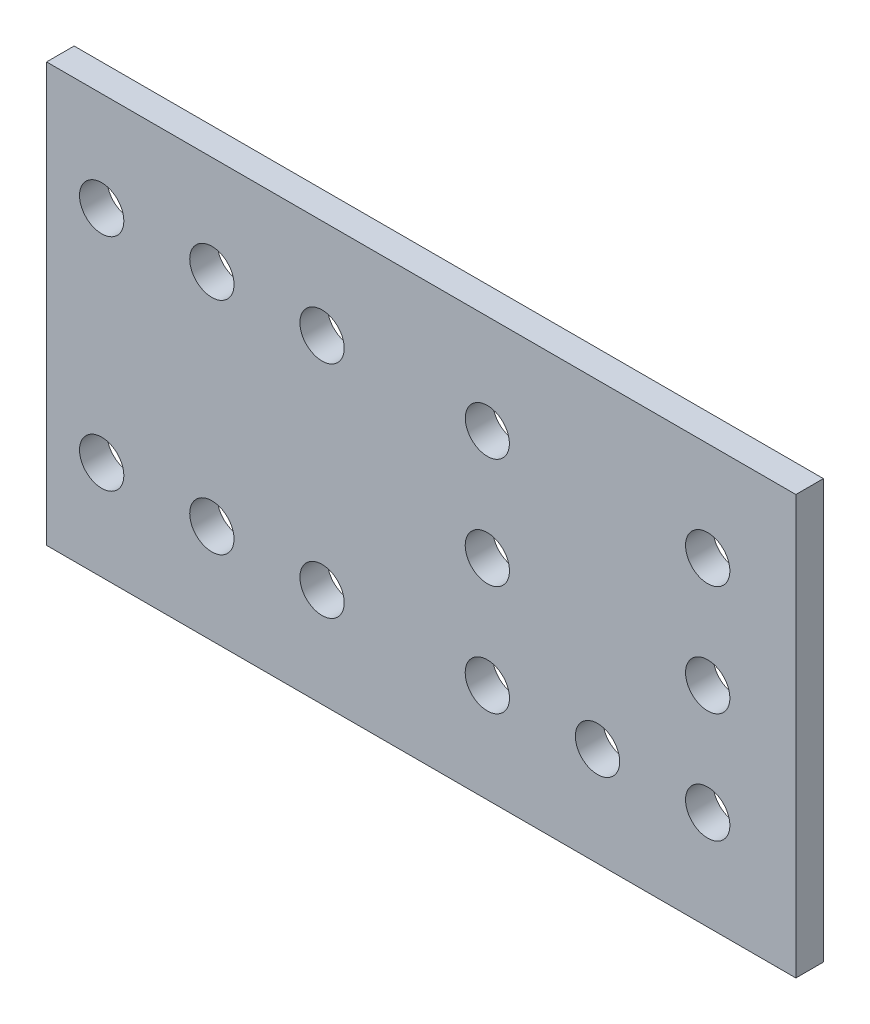
from build123d import *

# Parameters (mm, degrees)
SKETCH1_W               = 86.36
SKETCH1_H               = 48.26
BOSS_EXTRUDE1_DEPTH     = 3.175
CUT_EXTRUDE1_DEPTH      = 99.980593174
CUT_EXTRUDE1_DEPTH_BACK = 99.980593174
SKETCH2_R               = 2.5527
SKETCH3_R               = 2.5527
SKETCH3_R_2             = 2.54
CUT_EXTRUDE2_DEPTH      = 99.980593174
SKETCH4_R               = 2.5527
CUT_EXTRUDE3_DEPTH      = 99.980593174


with BuildPart() as part:
    # Sketch1 → Boss-Extrude1 (new body)
    with BuildSketch(Plane.XY):
        with Locations((43.18, 24.13)):
            Rectangle(SKETCH1_W, SKETCH1_H)
    extrude(amount=BOSS_EXTRUDE1_DEPTH)

    # Sketch2 → Cut-Extrude1 (cut, two sides: drawn at the far end of the back side and taken through both)
    with BuildSketch(Plane.XY.offset(3.175).offset(-CUT_EXTRUDE1_DEPTH_BACK)):
        with Locations((6.35, 36.83)):
            Circle(SKETCH2_R)
        with Locations((6.35, 11.43)):
            Circle(SKETCH2_R)
        with Locations((19.05, 36.83)):
            Circle(SKETCH2_R)
        with Locations((19.05, 11.43)):
            Circle(SKETCH2_R)
        with Locations((31.75, 36.83)):
            Circle(SKETCH2_R)
        with Locations((31.75, 11.43)):
            Circle(SKETCH2_R)
    extrude(amount=CUT_EXTRUDE1_DEPTH + CUT_EXTRUDE1_DEPTH_BACK, mode=Mode.SUBTRACT)

    # Sketch3 → Cut-Extrude2 (cut, through all)
    with BuildSketch(Plane(origin=(0, 0, 0), x_dir=(-1, 0, 0), z_dir=(0, 0, -1))):
        with Locations((-76.2, 36.83)):
            Circle(SKETCH3_R)
        with Locations((-76.2, 24.13)):
            Circle(SKETCH3_R)
        with Locations((-50.8, 36.83)):
            Circle(SKETCH3_R_2)
        with Locations((-50.8, 24.13)):
            Circle(SKETCH3_R)
    extrude(amount=-CUT_EXTRUDE2_DEPTH, mode=Mode.SUBTRACT)

    # Sketch4 → Cut-Extrude3 (cut, through all)
    with BuildSketch(Plane(origin=(0, 0, 0), x_dir=(-1, 0, 0), z_dir=(0, 0, -1))):
        with Locations((-76.2, 11.43)):
            Circle(SKETCH4_R)
        with Locations((-63.5, 11.43)):
            Circle(SKETCH4_R)
        with Locations((-50.8, 11.43)):
            Circle(SKETCH4_R)
    extrude(amount=-CUT_EXTRUDE3_DEPTH, mode=Mode.SUBTRACT)


solid = part.part
